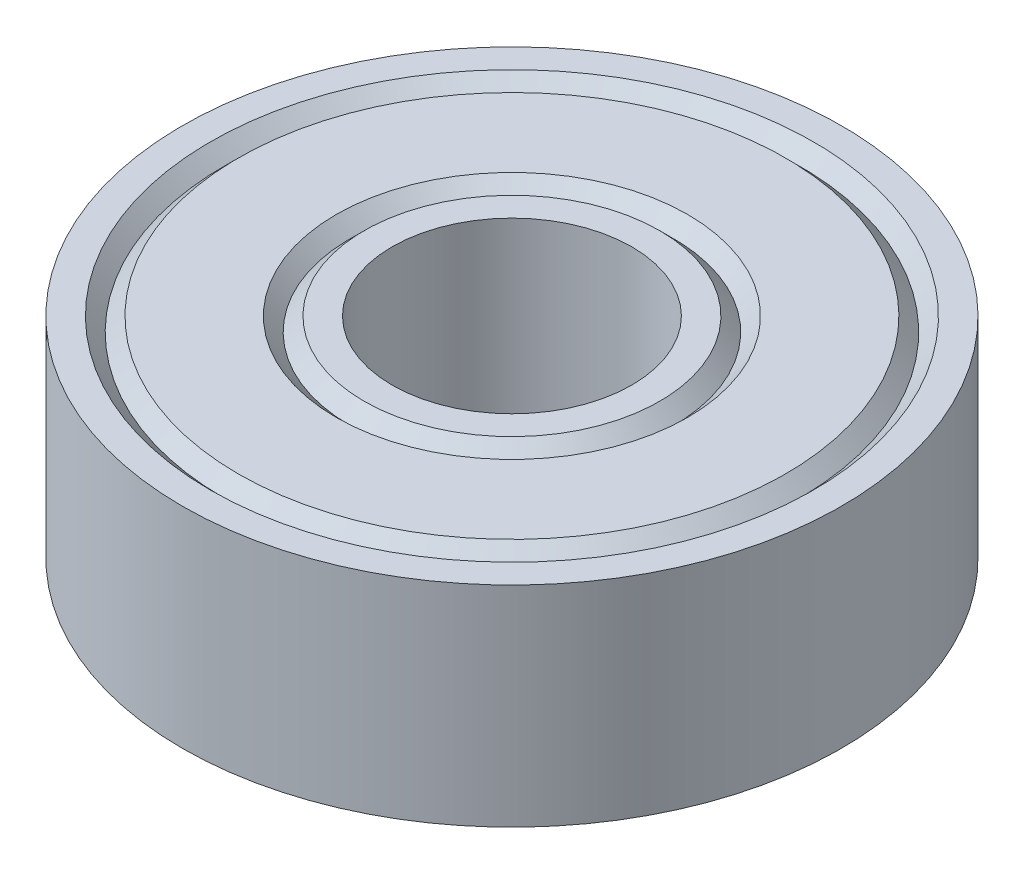
from build123d import *


with BuildPart() as part:
    # Sketch1 → Revolve1 (revolve)
    with BuildSketch(Plane.XY, mode=Mode.PRIVATE) as revolve1_sk:
        Polygon((-4, 3.5), (-4.933333333, 3.5), (-5.4, 3.033333333), (-5.866666667, 3.5), (-9.133333333, 3.5), (-9.6, 3.033333333), (-10.066666667, 3.5), (-11, 3.5), (-11, -3.5), (-10.066666667, -3.5), (-9.6, -3.033333333), (-9.133333333, -3.5), (-5.866666667, -3.5), (-5.4, -3.033333333), (-4.933333333, -3.5), (-4, -3.5), align=None)
    revolve(revolve1_sk.sketch.rotate(Axis((0, 3.5, 0), (0, -1, 0)), 270), axis=Axis((0, 3.5, 0), (0, -1, 0)))


solid = part.part
